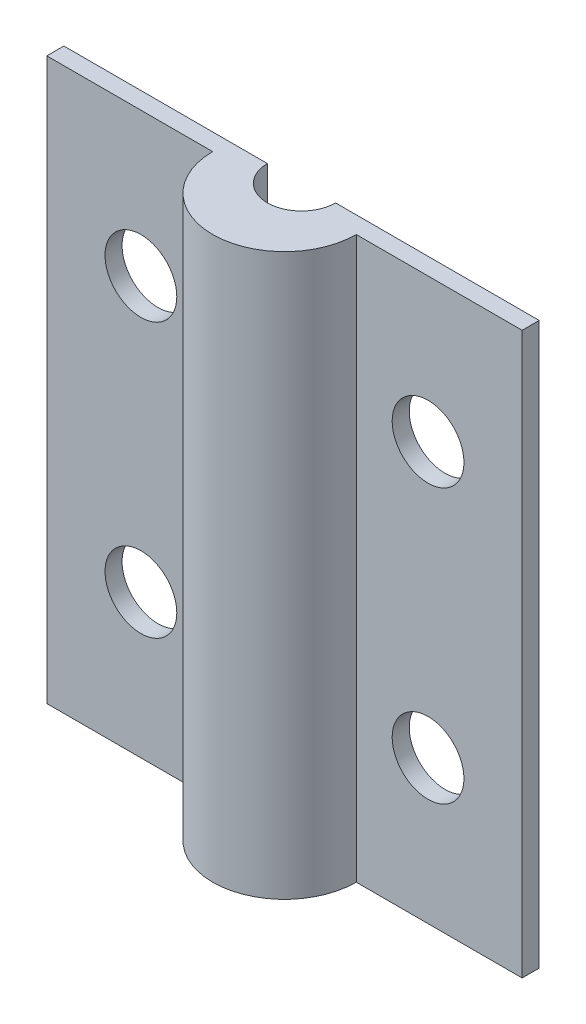
from build123d import *

# Parameters (mm, degrees)
SKETCH1_W               = 31.224798093
SKETCH1_H               = 19.847341298
BOSS_EXTRUDE1_DEPTH     = 3.302
SKETCH2_R               = 1.2065
CUT_EXTRUDE1_DEPTH      = 19.847341298
SKETCH3_W               = 6.232143457
SKETCH3_H               = 2.69875
CUT_EXTRUDE2_DEPTH      = 19.847341298
CUT_EXTRUDE4_DEPTH      = 19.847341298
SKETCH6_W               = 7.202949523
SKETCH6_H               = 3.302
CUT_EXTRUDE5_DEPTH      = 19.847341298
SKETCH7_R               = 1.27
CUT_EXTRUDE6_DEPTH      = 0.60325
MIRROR4_COPY_1_SKETCH_R = 1.27
MIRROR4_COPY_1_DEPTH    = 0.60325


with BuildPart() as part:
    # Sketch1 → Boss-Extrude1 (new body)
    with BuildSketch(Plane.XY):
        with Locations((-25.734325238, 15.946701424)):
            Rectangle(SKETCH1_W, SKETCH1_H)
    extrude(amount=BOSS_EXTRUDE1_DEPTH)

    # Sketch2 → Cut-Extrude1 (cut)
    with BuildSketch(Plane.XZ.offset(-6.023030775)):
        with Locations((-25.734325238, 0)):
            Circle(SKETCH2_R)
    extrude(amount=-CUT_EXTRUDE1_DEPTH, mode=Mode.SUBTRACT)

    # Sketch3 → Cut-Extrude2 (cut)
    with BuildSketch(Plane.XZ.offset(-6.023030775)):
        with Locations((-31.390396967, 1.952625)):
            Rectangle(SKETCH3_W, SKETCH3_H)
    cut_extrude2 = extrude(amount=-CUT_EXTRUDE2_DEPTH, mode=Mode.SUBTRACT)

    # Mirror1: Cut-Extrude2 across plane
    add(cut_extrude2.mirror(Plane.ZY.offset(25.734325238)), mode=Mode.SUBTRACT)

    # Sketch5 → Cut-Extrude4 (cut)
    with BuildSketch(Plane.XZ.offset(-6.023030775)):
        with BuildLine():
            Line((-28.274325238, 0.60325), (-28.274325238, 3.302))
            Line((-28.274325238, 3.302), (-23.194325238, 3.302))
            Line((-23.194325238, 3.302), (-23.194325238, 0.60325))
            ThreePointArc((-23.194325238, 0.60325), (-25.734325238, 3.14325), (-28.274325238, 0.60325))
        make_face()
    extrude(amount=-CUT_EXTRUDE4_DEPTH, mode=Mode.SUBTRACT)

    # Sketch6 → Cut-Extrude5 (cut)
    with BuildSketch(Plane.XZ.offset(-6.023030775)):
        with Locations((-37.745249523, 1.651)):
            Rectangle(SKETCH6_W, SKETCH6_H)
    cut_extrude5 = extrude(amount=-CUT_EXTRUDE5_DEPTH, mode=Mode.SUBTRACT)

    # Mirror2: Cut-Extrude5 across plane
    add(cut_extrude5.mirror(Plane.ZY.offset(25.734325238)), mode=Mode.SUBTRACT)

    # Sketch7 → Cut-Extrude6 (cut)
    with BuildSketch(Plane.XY.offset(0.60325)):
        with Locations((-30.814325238, 11.103030775)):
            Circle(SKETCH7_R)
    cut_extrude6 = extrude(amount=-CUT_EXTRUDE6_DEPTH, mode=Mode.SUBTRACT)

    # Mirror3: Cut-Extrude6 across plane
    add(cut_extrude6.mirror(Plane(origin=(0, 15.946701424, 0), x_dir=(0, 0, 1), z_dir=(0, -1, 0))), mode=Mode.SUBTRACT)

    # Mirror4: Cut-Extrude6 across plane
    add(cut_extrude6.mirror(Plane.ZY.offset(25.734325238)), mode=Mode.SUBTRACT)

    # Mirror4 copy 1 sketch → Mirror4 copy 1 (cut)
    with BuildSketch(Plane(origin=(-51.468650475, 31.893402848, 0.60325), x_dir=(-1, 0, 0), z_dir=(0, 0, 1))):
        with Locations((-30.814325238, 11.103030775)):
            Circle(MIRROR4_COPY_1_SKETCH_R)
    extrude(amount=-MIRROR4_COPY_1_DEPTH, mode=Mode.SUBTRACT)


solid = part.part
